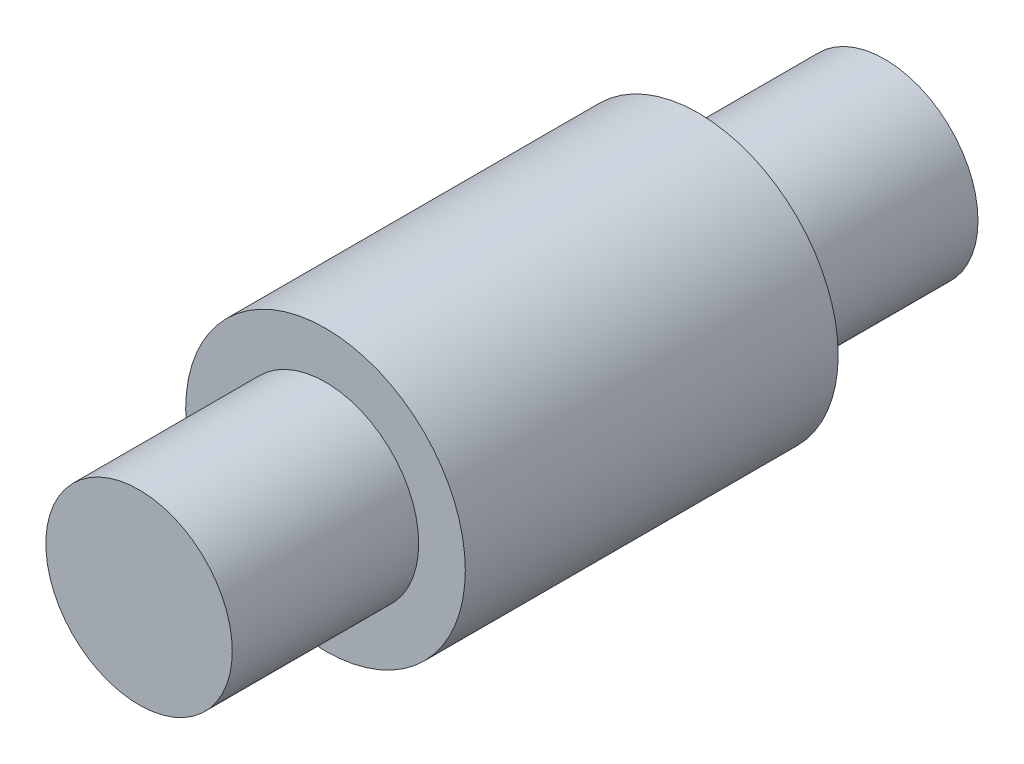
from build123d import *


with BuildPart() as part:
    # Sketch1 → Revolve1 (revolve)
    with BuildSketch(Plane(origin=(0, 0, 0), x_dir=(1, 0, 0), z_dir=(0, 1, 0))):
        Polygon((0, 0), (3.175, 0), (3.175, -6.35), (4.7625, -6.35), (4.7625, -19.05), (3.175, -19.05), (3.175, -25.4), (0, -25.4), align=None)
    revolve(axis=Axis((0, 0, 25.4), (0, 0, -1)))


solid = part.part
